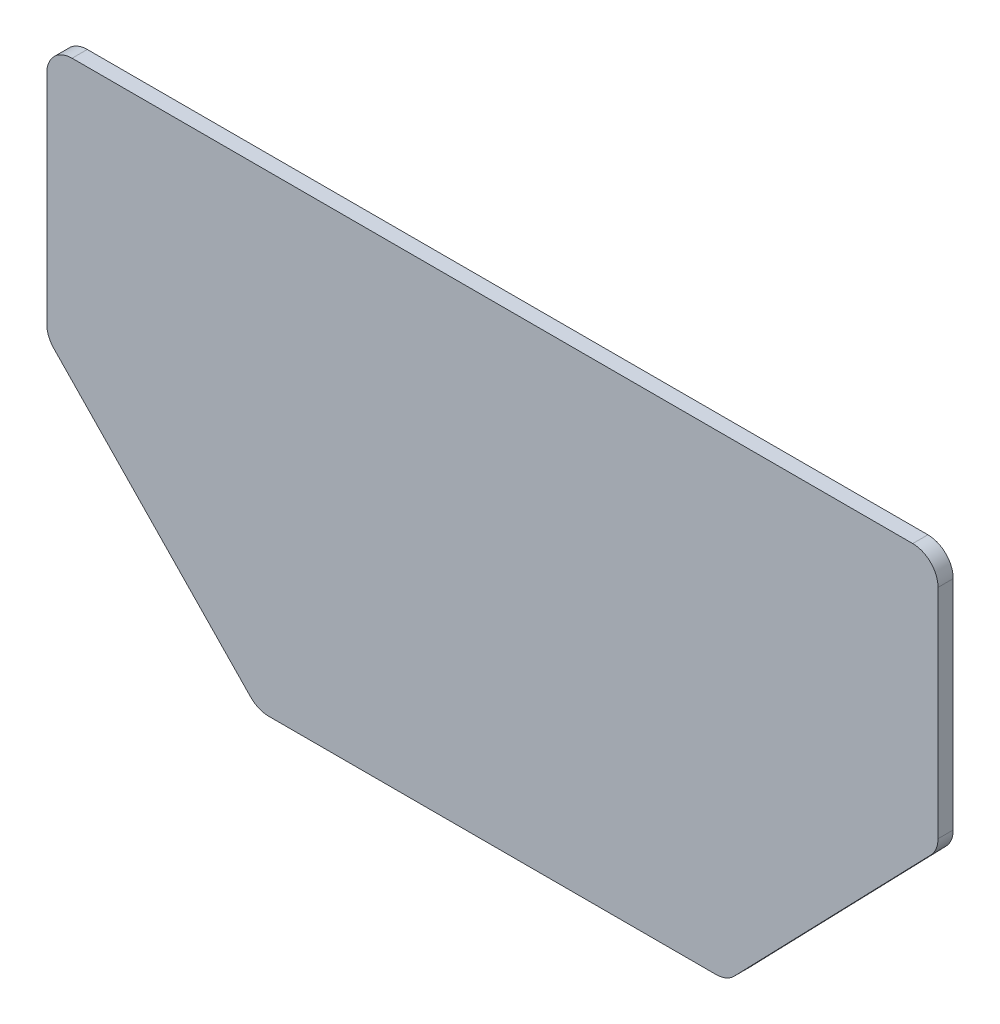
from build123d import *

# Parameters (mm, degrees)
BOSS_EXTRU_1_DEPTH = 6
CONG_1_R           = 10


with BuildPart() as part:
    # Esquisse1 → Boss.-Extru.1 (new body)
    with BuildSketch(Plane.XY):
        Polygon((-176, 100), (-176, 0), (-92.57, -86.25), (92.57, -86.25), (176, 0), (176, 100), align=None)
    extrude(amount=BOSS_EXTRU_1_DEPTH)

    # Congé1
    cong_1_edges = [part.edges().sort_by_distance(p)[0] for p in [
        (176, 100, 3),
        (176, 0, 3),
        (92.57, -86.25, 3),
        (-92.57, -86.25, 3),
        (-176, 0, 3),
        (-176, 100, 3),
    ]]
    fillet(cong_1_edges, radius=CONG_1_R)


solid = part.part
